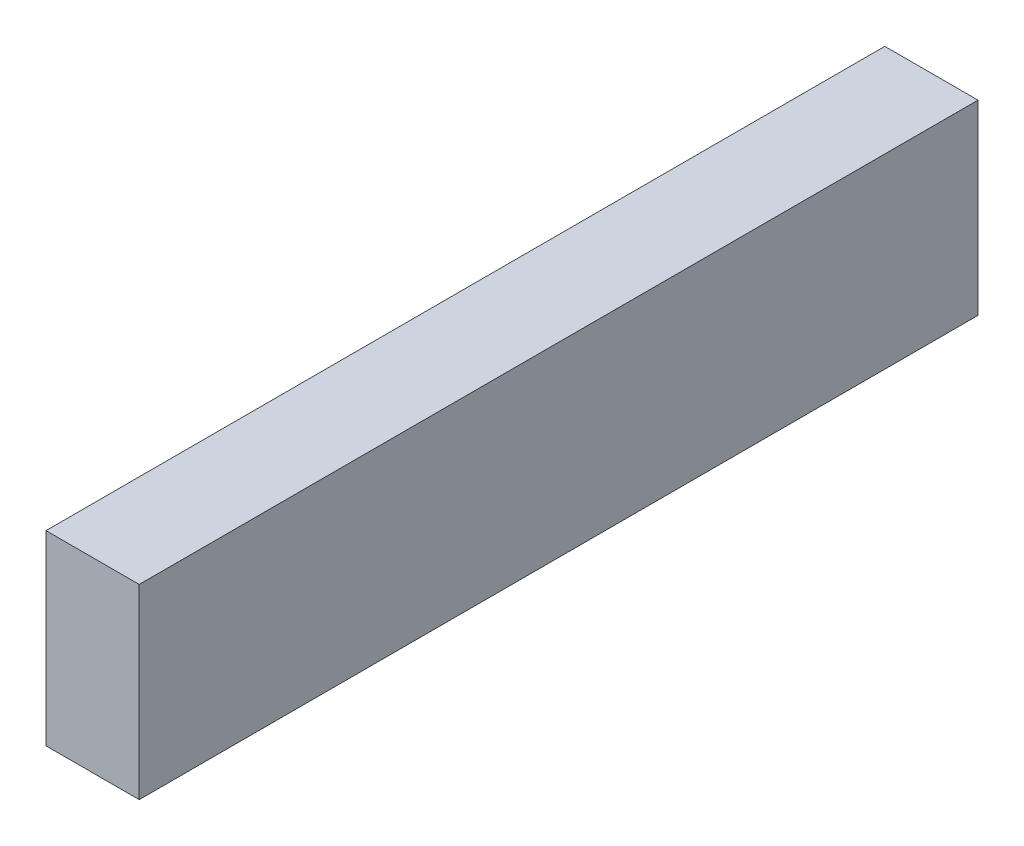
from build123d import *

# Parameters (mm, degrees)
SKETCH1_W           = 10
SKETCH1_H           = 20
BOSS_EXTRUDE1_DEPTH = 90


with BuildPart() as part:
    # Sketch1 → Boss-Extrude1 (new body)
    with BuildSketch(Plane.XY):
        Rectangle(SKETCH1_W, SKETCH1_H)
    extrude(amount=BOSS_EXTRUDE1_DEPTH)


solid = part.part
